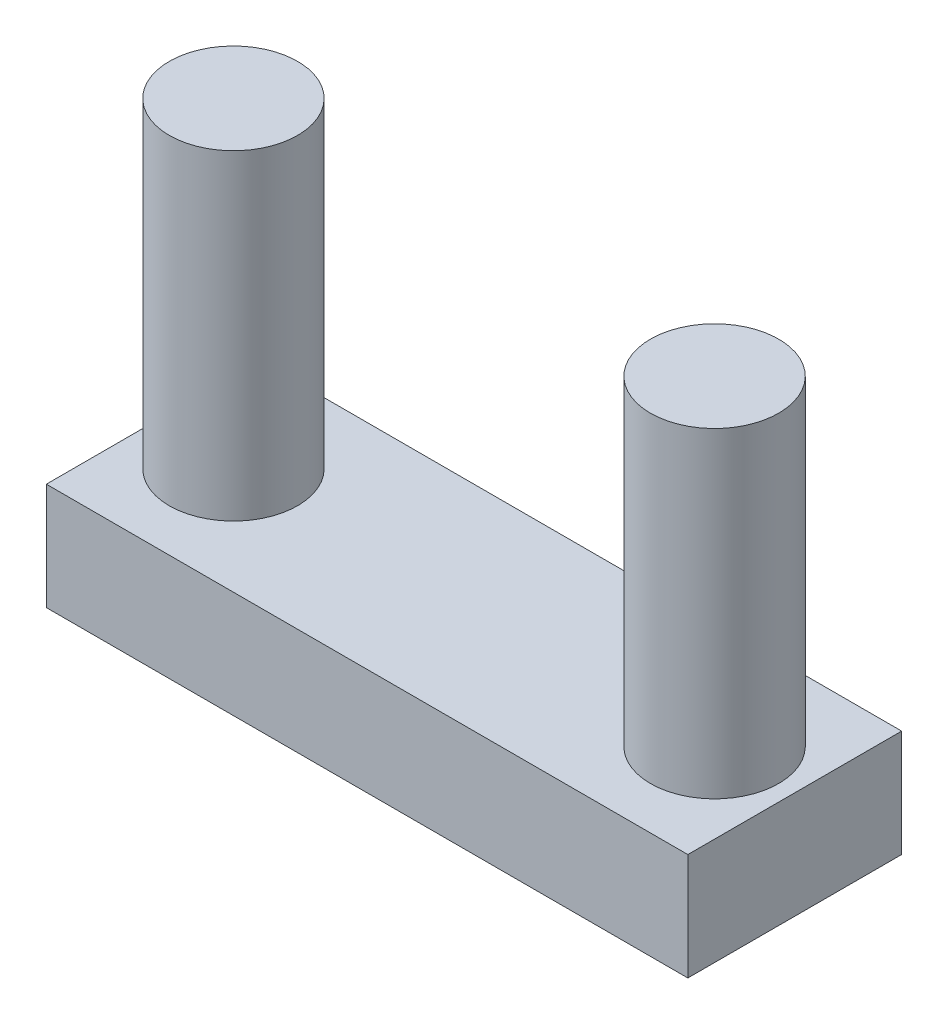
from build123d import *

# Parameters (mm, degrees)
SKETCH1_W           = 30
SKETCH1_H           = 10
SKETCH1_R           = 3
BOSS_EXTRUDE1_DEPTH = 5
SKETCH1_2_R         = 3
BOSS_EXTRUDE2_DEPTH = 20


with BuildPart() as part:
    # Sketch1 → Boss-Extrude1 (new body)
    with BuildSketch(Plane(origin=(0, 0, 0), x_dir=(1, 0, 0), z_dir=(0, 1, 0))):
        with Locations((11.25, 0)):
            Rectangle(SKETCH1_W, SKETCH1_H)
        Circle(SKETCH1_R, mode=Mode.SUBTRACT)
        with Locations((22.5, 0)):
            Circle(SKETCH1_R, mode=Mode.SUBTRACT)
    extrude(amount=BOSS_EXTRUDE1_DEPTH)

    # Sketch1<2> → Boss-Extrude2 (add)
    with BuildSketch(Plane(origin=(0, 0, 0), x_dir=(1, 0, 0), z_dir=(0, 1, 0))):
        Circle(SKETCH1_2_R)
        with Locations((22.5, 0)):
            Circle(SKETCH1_2_R)
    extrude(amount=BOSS_EXTRUDE2_DEPTH)


solid = part.part
